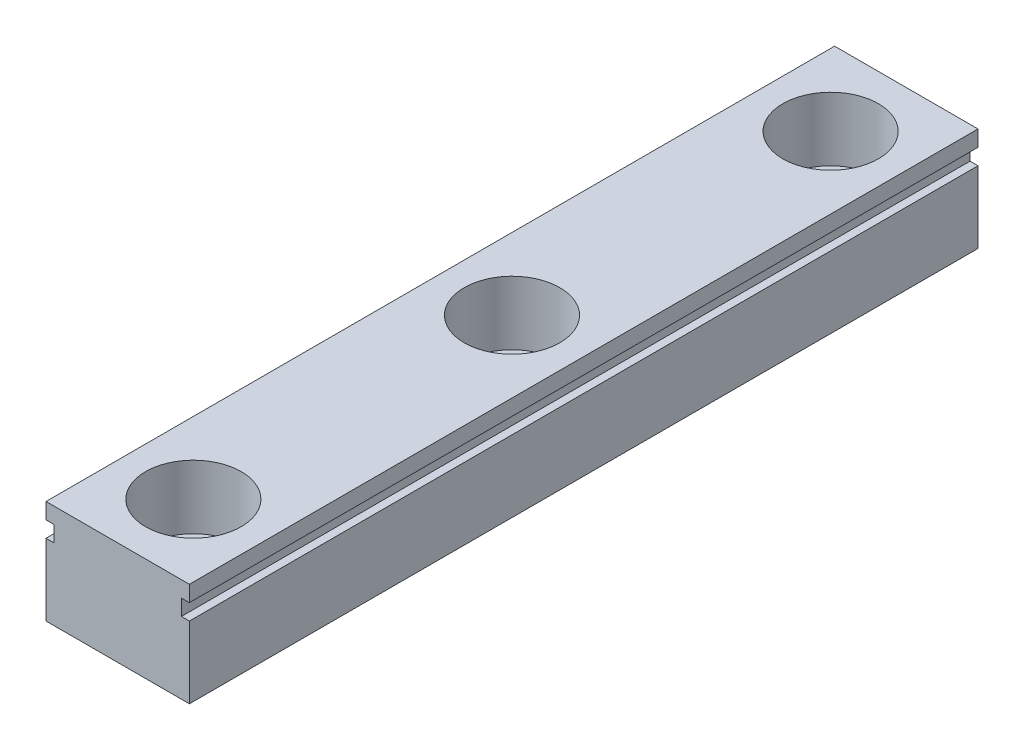
from build123d import *

# Parameters (mm, degrees)
SKETCH_1_W          = 9
SKETCH_1_H          = 49.5
EXTRUDE_1_DEPTH     = 6.5
SKETCH_2_R          = 1.55
CUT_EXTRUDE_1_DEPTH = 51.729675733
SKETCH_3_R          = 3
CUT_EXTRUDE_2_DEPTH = 4
SKETCH_4_W          = 0.5
SKETCH_4_H          = 1
CUT_EXTRUDE_3_DEPTH = 51.729675733


with BuildPart() as part:
    # 草图1 → 凸台-拉伸1 (new body)
    with BuildSketch(Plane(origin=(0, 0, 0), x_dir=(1, 0, 0), z_dir=(0, 1, 0))):
        with Locations((4.5, -24.75)):
            Rectangle(SKETCH_1_W, SKETCH_1_H)
    extrude(amount=EXTRUDE_1_DEPTH)

    # 草图2 → 切除-拉伸1 (cut, through all)
    with BuildSketch(Plane(origin=(0, 6.5, 0), x_dir=(1, 0, 0), z_dir=(0, 1, 0))):
        with Locations(Location((4.5, -24.75, 0), (0, 0, 270))):
            Circle(SKETCH_2_R)
        with Locations(Location((4.5, -4.75, 0), (0, 0, 270))):
            Circle(SKETCH_2_R)
        with Locations(Location((4.5, -44.75, 0), (0, 0, 270))):
            Circle(SKETCH_2_R)
    extrude(amount=-CUT_EXTRUDE_1_DEPTH, mode=Mode.SUBTRACT)

    # 草图3 → 切除-拉伸2 (cut)
    with BuildSketch(Plane(origin=(0, 6.5, 0), x_dir=(1, 0, 0), z_dir=(0, 1, 0))):
        with Locations(Location((4.5, -44.75, 0), (0, 0, 270))):
            Circle(SKETCH_3_R)
        with Locations(Location((4.5, -24.75, 0), (0, 0, 270))):
            Circle(SKETCH_3_R)
        with Locations(Location((4.5, -4.75, 0), (0, 0, 270))):
            Circle(SKETCH_3_R)
    extrude(amount=-CUT_EXTRUDE_2_DEPTH, mode=Mode.SUBTRACT)

    # 草图4 → 切除-拉伸3 (cut, through all)
    with BuildSketch(Plane.XY.offset(49.5)):
        with Locations((0.25, 5)):
            Rectangle(SKETCH_4_W, SKETCH_4_H)
        with Locations((8.75, 5)):
            Rectangle(SKETCH_4_W, SKETCH_4_H)
    extrude(amount=-CUT_EXTRUDE_3_DEPTH, mode=Mode.SUBTRACT)


solid = part.part
